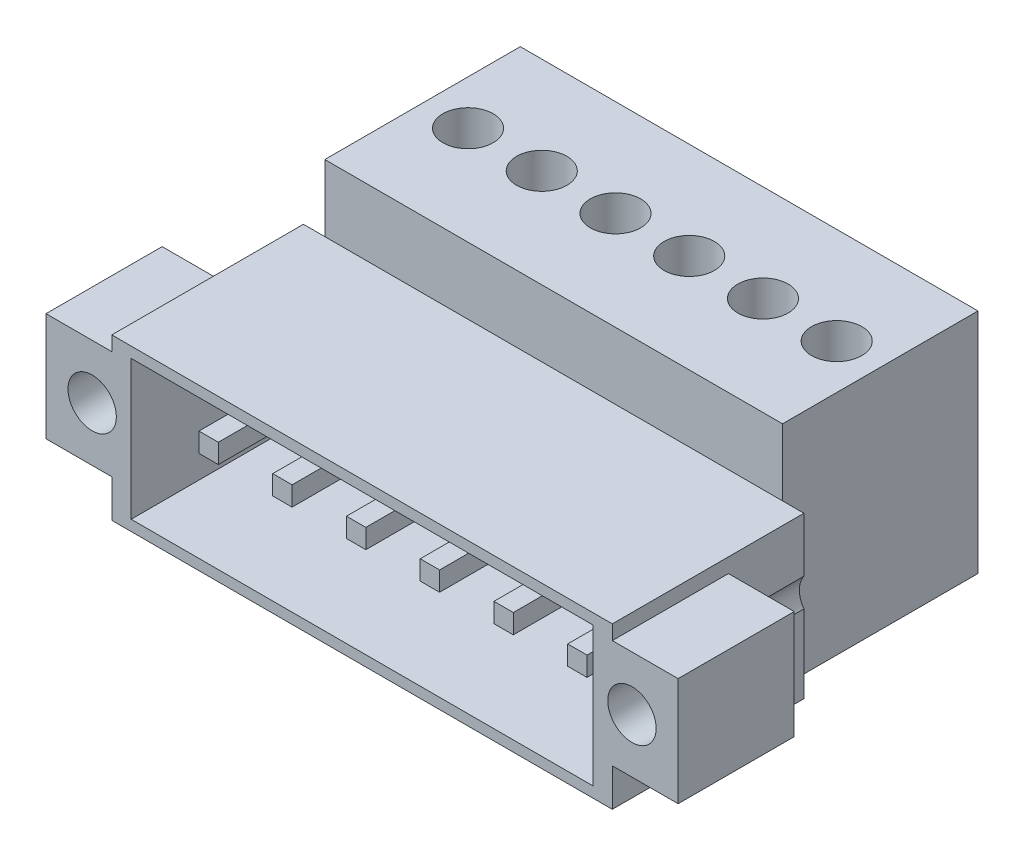
from build123d import *

# Parameters (mm, degrees)
SK_SHROUD_W             = 25.86
SK_SHROUD_H             = 8.3
SHROUD_DEPTH            = 9.9
SK_FLANGE_EARS_W        = 3.4
SK_FLANGE_EARS_H        = 5.6
FLANGE_EARS_DEPTH       = 6
SK_CAVITY_W             = 23.86
SK_CAVITY_H             = 7.2
CAVITY_DEPTH            = 7.6
SK_TERMINAL_BLOCK_W     = 23.65
SK_TERMINAL_BLOCK_H     = 11.75
TERMINAL_BLOCK_DEPTH    = 10.1
INSERT_HOLES_DEPTH      = 25.590016267
INSERT_HOLES_DEPTH_BACK = 25.590016267
SK_INSERT_HOLES_R       = 1.25
SK_CONTACT_PINS_W       = 1
SK_CONTACT_PINS_H       = 1
CONTACT_PINS_DEPTH      = 6
SK_WIRE_ENTRIES_W       = 2.6
SK_WIRE_ENTRIES_H       = 2.8
WIRE_ENTRIES_DEPTH      = 6
SK_CLAMP_SCREW_HOLES_R  = 1.3
CLAMP_SCREW_HOLES_DEPTH = 3


with BuildPart() as part:
    # SK Shroud → Shroud (new body)
    with BuildSketch(Plane.XY.offset(3)):
        with Locations((0, -0.6)):
            Rectangle(SK_SHROUD_W, SK_SHROUD_H)
    extrude(amount=-SHROUD_DEPTH)

    # SK Flange ears → Flange ears (add)
    with BuildSketch(Plane.XY.offset(3)):
        with Locations((14.63, 0)):
            Rectangle(SK_FLANGE_EARS_W, SK_FLANGE_EARS_H)
        with Locations((-14.63, 0)):
            Rectangle(SK_FLANGE_EARS_W, SK_FLANGE_EARS_H)
    extrude(amount=-FLANGE_EARS_DEPTH)

    # SK Cavity → Cavity (cut)
    with BuildSketch(Plane.XY.offset(3)):
        with Locations((0, -0.6)):
            Rectangle(SK_CAVITY_W, SK_CAVITY_H)
    extrude(amount=-CAVITY_DEPTH, mode=Mode.SUBTRACT)

    # SK Terminal block → Terminal block (add)
    with BuildSketch(Plane.XY.offset(-6.9)):
        with Locations((0, 1.125)):
            Rectangle(SK_TERMINAL_BLOCK_W, SK_TERMINAL_BLOCK_H)
    extrude(amount=-TERMINAL_BLOCK_DEPTH)

    # SK Insert holes → Insert holes (cut, two sides: drawn at the far end of the back side and taken through both)
    with BuildSketch(Plane.XY.offset(-INSERT_HOLES_DEPTH_BACK)):
        with Locations((-13.945, 0)):
            Circle(SK_INSERT_HOLES_R)
        with Locations((13.945, 0)):
            Circle(SK_INSERT_HOLES_R)
    extrude(amount=INSERT_HOLES_DEPTH + INSERT_HOLES_DEPTH_BACK, mode=Mode.SUBTRACT)

    # SK Contact pins → Contact pins (add)
    with BuildSketch(Plane.XY.offset(-4.6)):
        with Locations((-9.525, -0.6)):
            Rectangle(SK_CONTACT_PINS_W, SK_CONTACT_PINS_H)
        with Locations((-5.715, -0.6)):
            Rectangle(SK_CONTACT_PINS_W, SK_CONTACT_PINS_H)
        with Locations((-1.905, -0.6)):
            Rectangle(SK_CONTACT_PINS_W, SK_CONTACT_PINS_H)
        with Locations((1.905, -0.6)):
            Rectangle(SK_CONTACT_PINS_W, SK_CONTACT_PINS_H)
        with Locations((5.715, -0.6)):
            Rectangle(SK_CONTACT_PINS_W, SK_CONTACT_PINS_H)
        with Locations((9.525, -0.6)):
            Rectangle(SK_CONTACT_PINS_W, SK_CONTACT_PINS_H)
    extrude(amount=CONTACT_PINS_DEPTH)

    # SK Wire entries → Wire entries (cut)
    with BuildSketch(Plane.XY.offset(-17)):
        with Locations((-9.525, -2)):
            Rectangle(SK_WIRE_ENTRIES_W, SK_WIRE_ENTRIES_H)
        with Locations((-5.715, -2)):
            Rectangle(SK_WIRE_ENTRIES_W, SK_WIRE_ENTRIES_H)
        with Locations((-1.905, -2)):
            Rectangle(SK_WIRE_ENTRIES_W, SK_WIRE_ENTRIES_H)
        with Locations((1.905, -2)):
            Rectangle(SK_WIRE_ENTRIES_W, SK_WIRE_ENTRIES_H)
        with Locations((5.715, -2)):
            Rectangle(SK_WIRE_ENTRIES_W, SK_WIRE_ENTRIES_H)
        with Locations((9.525, -2)):
            Rectangle(SK_WIRE_ENTRIES_W, SK_WIRE_ENTRIES_H)
    extrude(amount=WIRE_ENTRIES_DEPTH, mode=Mode.SUBTRACT)

    # SK Clamp screw holes → Clamp screw holes (cut)
    with BuildSketch(Plane(origin=(0, 7, 0), x_dir=(1, 0, 0), z_dir=(0, 1, 0))):
        with Locations(Location((-9.525, 12, 0), (0, 0, 270))):
            Circle(SK_CLAMP_SCREW_HOLES_R)
        with Locations(Location((-5.715, 12, 0), (0, 0, 270))):
            Circle(SK_CLAMP_SCREW_HOLES_R)
        with Locations(Location((-1.905, 12, 0), (0, 0, 270))):
            Circle(SK_CLAMP_SCREW_HOLES_R)
        with Locations(Location((1.905, 12, 0), (0, 0, 270))):
            Circle(SK_CLAMP_SCREW_HOLES_R)
        with Locations(Location((5.715, 12, 0), (0, 0, 270))):
            Circle(SK_CLAMP_SCREW_HOLES_R)
        with Locations(Location((9.525, 12, 0), (0, 0, 270))):
            Circle(SK_CLAMP_SCREW_HOLES_R)
    extrude(amount=-CLAMP_SCREW_HOLES_DEPTH, mode=Mode.SUBTRACT)


solid = part.part
